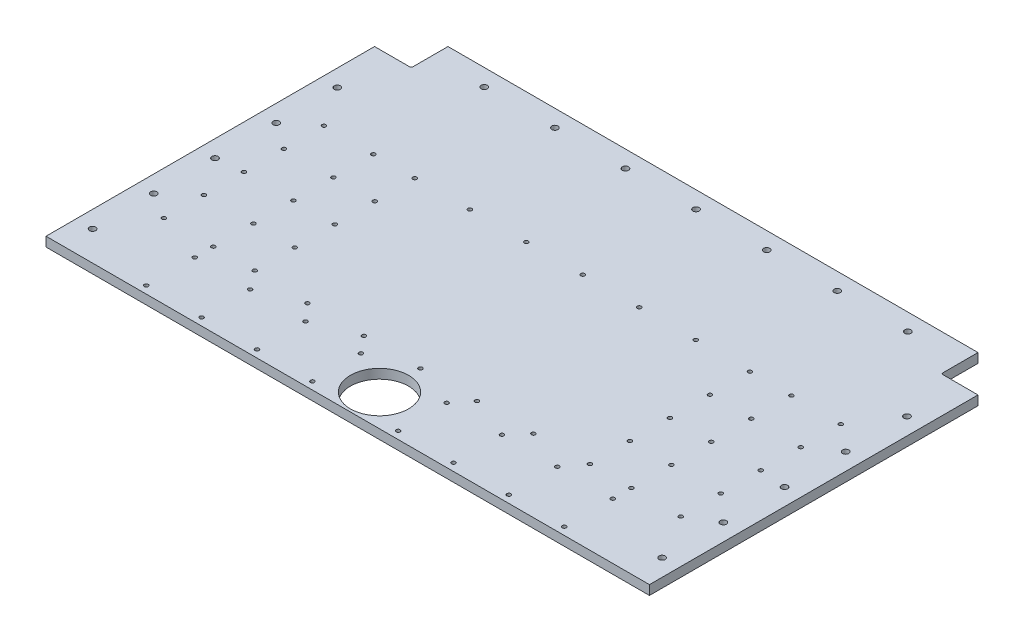
from build123d import *

# Parameters (mm, degrees)
SKETCH_1_W                 = 641
SKETCH_1_H                 = 388
EXTRUDE_799_DEPTH          = 10
HOLE_WIZARD_M6_D           = 6.6
HOLE_WIZARD_M6_CSINK_D     = 12.6
HOLE_WIZARD_M6_CSINK_ANGLE = 90
SKETCH_4_W                 = 39
SKETCH_4_H                 = 39
CUT_EXTRUDE_2231_DEPTH     = 375.774932459
FILLET_1_R                 = 1.5
HOLE_WIZARD_M5_D           = 4.2
SKETCH_8_R                 = 30.9
CUT_EXTRUDE_8917_DEPTH     = 375.774932459


with BuildPart() as part:
    # Эскиз1 → Extrude 799 (new body)
    with BuildSketch(Plane(origin=(0, 0, 0), x_dir=(1, 0, 0), z_dir=(0, 1, 0))):
        Rectangle(SKETCH_1_W, SKETCH_1_H)
    extrude(amount=EXTRUDE_799_DEPTH)

    # Винты M6 (through all)
    with Locations(Plane(origin=(0, 0, 0), x_dir=(-1, 0, 0), z_dir=(0, -1, 0))):
        with Locations((-302.5, -97.5), (-302.5, -32.5), (-302.5, 32.5), (-302.5, 97.5), (0, 176), (-75, 176), (-150, 176), (-225, 176), (-302.5, -162.5)):
            hole_wizard_m6 = CounterSinkHole(HOLE_WIZARD_M6_D / 2, HOLE_WIZARD_M6_CSINK_D / 2, counter_sink_angle=HOLE_WIZARD_M6_CSINK_ANGLE)

    # Зеркальное отражение1: Винты M6 across plane
    add(hole_wizard_m6.mirror(Plane(origin=(0, 0, 0), x_dir=(0, 0, 1), z_dir=(1, 0, 0))), mode=Mode.SUBTRACT)

    # Эскиз4 → Cut-Extrude 2231 (cut, through all)
    with BuildSketch(Plane.XZ):
        with Locations((-301, -174.5)):
            Rectangle(SKETCH_4_W, SKETCH_4_H)
        with Locations((301, -174.5)):
            Rectangle(SKETCH_4_W, SKETCH_4_H)
    extrude(amount=-CUT_EXTRUDE_2231_DEPTH, mode=Mode.SUBTRACT)

    # Скругление1
    fillet_1_edges = [part.edges().sort_by_distance(p)[0] for p in [
        (-281.5, 5, -155),
        (281.5, 5, -155),
    ]]
    fillet(fillet_1_edges, radius=FILLET_1_R)

    # M5 (through all)
    with Locations(Plane(origin=(0, 0, 0), x_dir=(-1, 0, 0), z_dir=(0, -1, 0))):
        with Locations((0, 55.7), (-60, 55.7), (-120, 55.7), (60, 55.7), (120, 55.7), (120, -116.8), (60, -116.8), (0, -116.8), (-60, -116.8), (-120, -116.8), (274.5, -114.75), (274.5, -29.75), (274.5, 55.25), (274.5, 12.75), (274.5, -72.25), (-274.5, 55.25), (-274.5, 12.75), (-274.5, -29.75), (-274.5, -72.25), (-274.5, -114.75), (222, 55.25), (178, 55.25), (222, 12.75), (178, 12.75), (222, -29.75), (178, -29.75), (222, -72.25), (178, -72.25), (178, -114.75), (222, -114.75), (-222, 55.25), (-178, 55.25), (-178, 12.75), (-222, 12.75), (-222, -29.75), (-178, -29.75), (-178, -72.25), (-222, -72.25), (-222, -114.75), (-178, -114.75), (222, -134.5), (222, -186), (163.166666667, -134.5), (104.333333333, -134.5), (45.5, -134.5), (45.5, -186), (104.333333333, -186), (163.166666667, -186), (-45.5, -134.5), (-104.333333333, -134.5), (-163.166666667, -134.5), (-222, -134.5), (-222, -186), (-163.166666667, -186), (-104.333333333, -186), (-45.5, -186)):
            Hole(HOLE_WIZARD_M5_D / 2)

    # Эскиз8 → Cut-Extrude 8917 (cut, through all)
    with BuildSketch(Plane(origin=(0, 10, 0), x_dir=(1, 0, 0), z_dir=(0, 1, 0))):
        with Locations(Location((0, -160.25, 0), (0, 0, 270))):
            Circle(SKETCH_8_R)
    extrude(amount=-CUT_EXTRUDE_8917_DEPTH, mode=Mode.SUBTRACT)


solid = part.part
